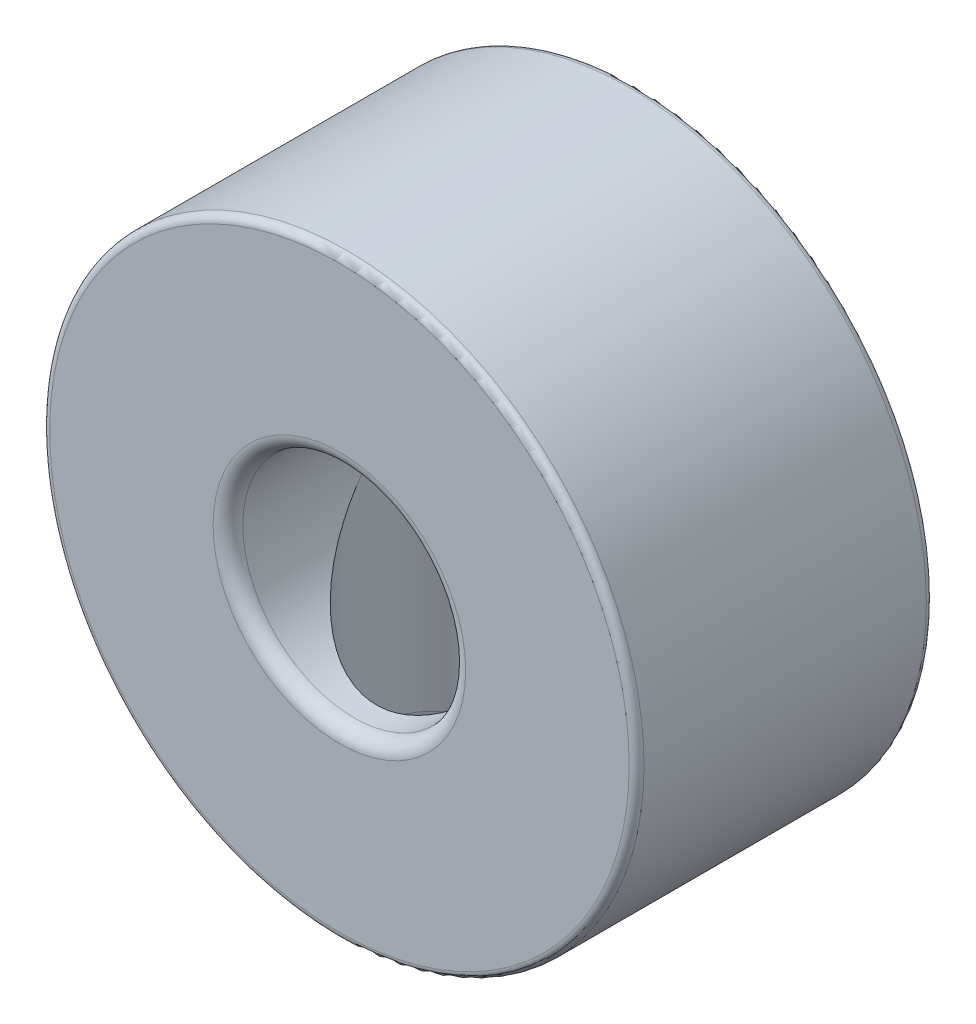
from build123d import *

# Parameters (mm, degrees)
CROQUIS1_R              = 4
CROQUIS1_R_2            = 1.5
SALIENTE_EXTRUIR1_DEPTH = 4
CROQUIS2_R              = 1.5
CORTAR_EXTRUIR1_DEPTH   = 4
REDONDEO1_R             = 0.1
REDONDEO2_R             = 0.1
REDONDEO3_R             = 0.2
REDONDEO4_R             = 0.2
REDONDEO5_R             = 0.3


with BuildPart() as part:
    # Croquis1 → Saliente-Extruir1 (new body)
    with BuildSketch(Plane.XY):
        Circle(CROQUIS1_R)
        Circle(CROQUIS1_R_2, mode=Mode.SUBTRACT)
    extrude(amount=SALIENTE_EXTRUIR1_DEPTH)

    # Croquis2 → Cortar-Extruir1 (cut)
    with BuildSketch(Plane(origin=(0, 0, 0), x_dir=(1, 0, 0), z_dir=(0, 1, 0))):
        with Locations(Location((-0.002438694, -2, 0), (0, 0, 183.26760452))):
            Circle(CROQUIS2_R)
    extrude(amount=-CORTAR_EXTRUIR1_DEPTH, mode=Mode.SUBTRACT)

    # Redondeo1
    redondeo1_edges = [part.edges().sort_by_distance(p)[0] for p in [
        (-4, 0, 4),
    ]]
    fillet(redondeo1_edges, radius=REDONDEO1_R)

    # Redondeo2
    redondeo2_edges = [part.edges().sort_by_distance(p)[0] for p in [
        (-4, 0, 0),
    ]]
    fillet(redondeo2_edges, radius=REDONDEO2_R)

    # Redondeo3
    redondeo3_edges = [part.edges().sort_by_distance(p)[0] for p in [
        (-1.5, 0, 4),
    ]]
    fillet(redondeo3_edges, radius=REDONDEO3_R)

    # Redondeo4
    redondeo4_edges = [part.edges().sort_by_distance(p)[0] for p in [
        (-1.5, 0, 0),
    ]]
    fillet(redondeo4_edges, radius=REDONDEO4_R)

    # Redondeo5
    redondeo5_edges = [part.edges().sort_by_distance(p)[0] for p in [
        (1.49512261, -3.710068514, 1.91450062),
    ]]
    fillet(redondeo5_edges, radius=REDONDEO5_R)


solid = part.part
